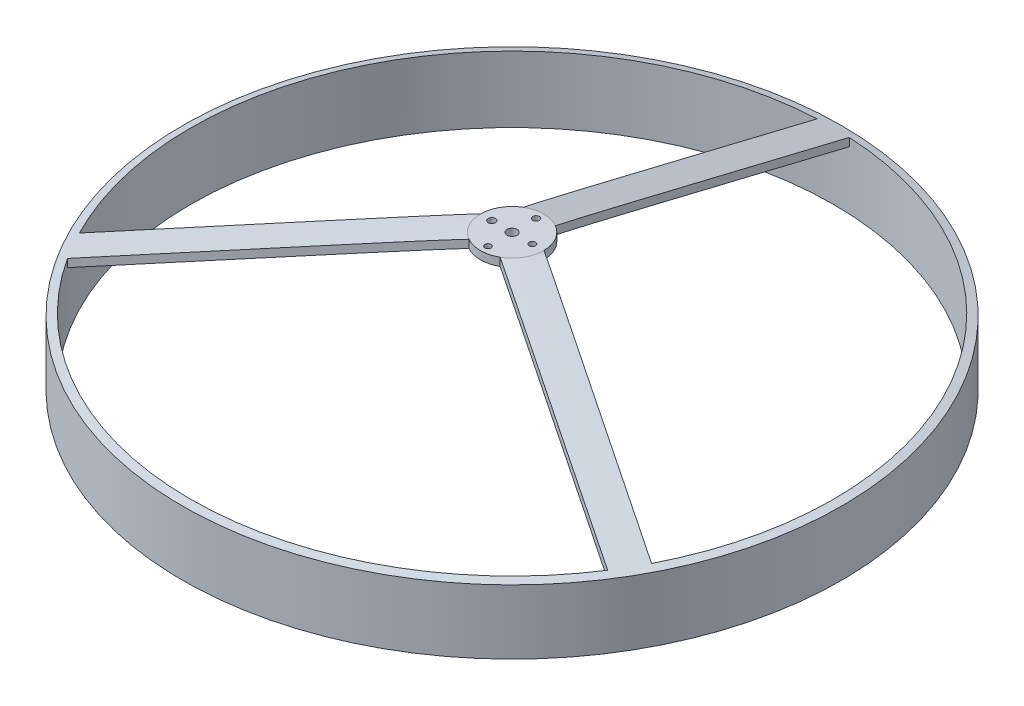
from build123d import *
from build123d.topology import SkipClean

# Parameters (mm, degrees)
CUT_EXTRUDE1_DEPTH = 192.844629518
SKETCH5_R          = 2
SKETCH5_R_2        = 1.215079891
SKETCH5_R_3        = 1.250300915
SKETCH5_R_4        = 1.322330992
SKETCH5_R_5        = 1.447889858
CUT_EXTRUDE3_DEPTH = 191.975656334


with BuildPart() as part:
    # Sketch1 → Revolve1 (revolve)
    with BuildSketch(Plane.XY, mode=Mode.PRIVATE) as revolve1_sk:
        Polygon((0, 50.8), (0, 53.975), (12.5, 53.975), (130.175, 25.4), (130.175, 0), (127, 0), (127, 22.995984704), (12.5, 50.8), align=None)
    revolve(revolve1_sk.sketch.rotate(Axis((0, 50.8, 0), (0, 1, 0)), 90), axis=Axis((0, 50.8, 0), (0, 1, 0)))

    # Sketch2 → Cut-Extrude1 (cut, through all)
    with SkipClean():  # the faces are left unmerged after this step: merging them gives an invalid solid
        with BuildSketch(Plane(origin=(0, 53.975, 0), x_dir=(1, 0, 0), z_dir=(0, 1, 0))):
            with BuildLine():
                ThreePointArc((-12.499463792, 0.115779634), (-10.825317547, 6.25), (-6.35, 10.76696336))
                Line((-6.35, 10.76696336), (-6.35, 126.841150657))
                ThreePointArc((-6.35, 126.841150657), (-109.985226281, 63.5), (-113.022658714, -57.921314014))
                Line((-113.022658714, -57.921314014), (-12.499463792, 0.115779634))
            make_face()
            with BuildLine():
                Line((6.35, 126.841150657), (6.35, 10.76696336))
                ThreePointArc((6.35, 10.76696336), (10.825317547, 6.25), (12.499463792, 0.115779634))
                Line((12.499463792, 0.115779634), (113.022658714, -57.921314014))
                ThreePointArc((113.022658714, -57.921314014), (109.985226281, 63.5), (6.35, 126.841150657))
            make_face()
            with BuildLine():
                ThreePointArc((6.149463792, -10.882742994), (0, -12.5), (-6.149463792, -10.882742994))
                Line((-6.149463792, -10.882742994), (-106.672658714, -68.919836643))
                ThreePointArc((-106.672658714, -68.919836643), (0, -127), (106.672658714, -68.919836643))
                Line((106.672658714, -68.919836643), (6.149463792, -10.882742994))
            make_face()
        extrude(amount=-CUT_EXTRUDE1_DEPTH, mode=Mode.SUBTRACT)

    # Sketch5 → Cut-Extrude3 (cut, through all)
    with BuildSketch(Plane.XZ.offset(-50.8)):
        with Locations(Location((0, 0, 0), (0, 0, 270))):
            Circle(SKETCH5_R)
        with Locations(Location((0, 9.5, 0), (0, 0, 270))):
            Circle(SKETCH5_R_2)
        with Locations(Location((8, 0, 0), (0, 0, 270))):
            Circle(SKETCH5_R_3)
        with Locations(Location((0, -9.5, 0), (0, 0, 270))):
            Circle(SKETCH5_R_4)
        with Locations(Location((-8, 0, 0), (0, 0, 270))):
            Circle(SKETCH5_R_5)
    extrude(amount=-CUT_EXTRUDE3_DEPTH, mode=Mode.SUBTRACT)


solid = part.part
